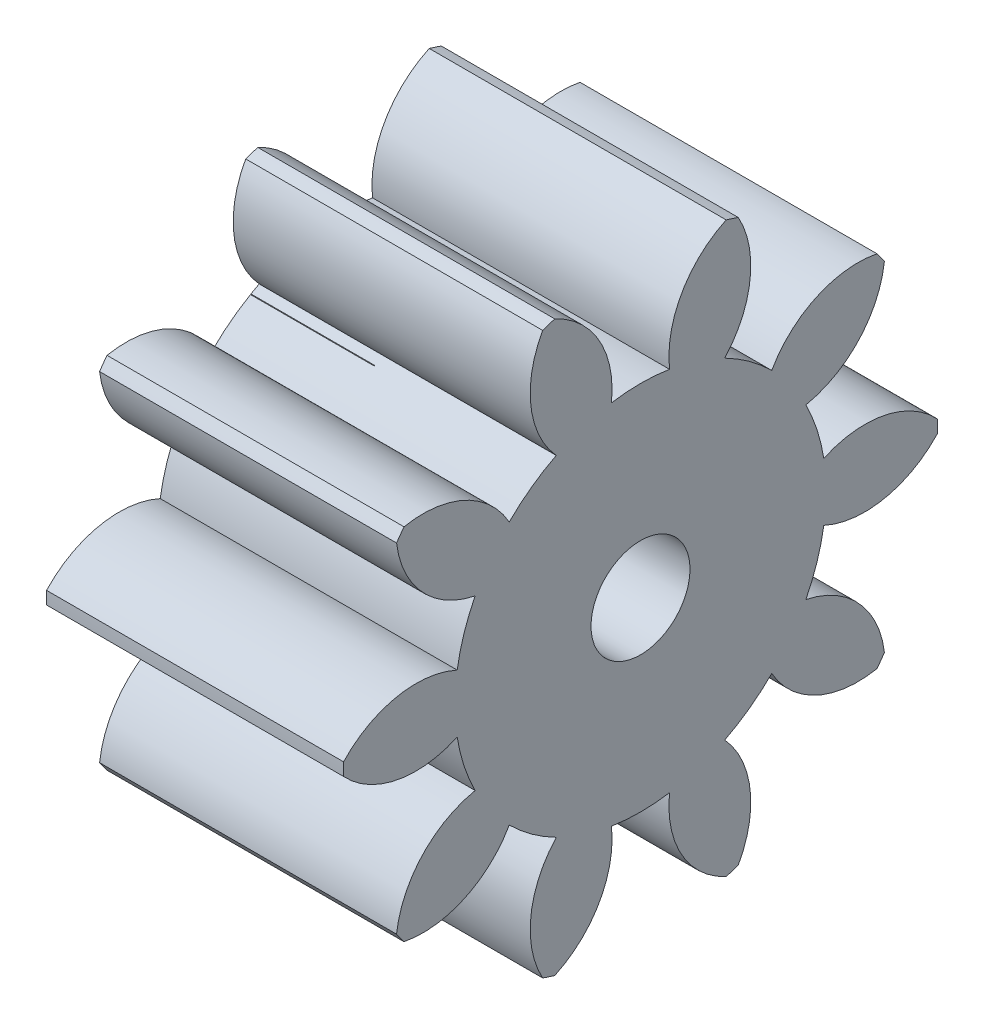
from build123d import *

# Parameters (mm, degrees)
BASPROSKE_W         = 12
BASPROSKE_H         = 12
TOOTHCUT_DEPTH      = 21.784609691
TEETHCUTS_COUNT     = 10
TEETHCUTS_ANGLE     = 324
BORSKE_R            = 2
BORE_DEPTH          = 50.0000508
CUT_EXTRUDE_1_DEPTH = 5


with BuildPart() as part:
    # BasProSke → Base-Revolve (revolve)
    with BuildSketch(Plane(origin=(0, 0, 0), x_dir=(1, 0, 0), z_dir=(0, 1, 0)), mode=Mode.PRIVATE) as base_revolve_sk:
        with Locations((6, 6)):
            Rectangle(BASPROSKE_W, BASPROSKE_H)
    revolve(base_revolve_sk.sketch.rotate(Axis((-10, 0, 0), (1, 0, 0)), 180), axis=Axis((-10, 0, 0), (1, 0, 0)))

    # TooCutSke → ToothCut (cut, through all)
    with BuildSketch(Plane(origin=(0, 0, 0), x_dir=(0, 0, -1), z_dir=(1, 0, 0))):
        with BuildLine():
            ThreePointArc((1.173662691, 7.406586048), (0, 7.499), (-1.173662691, 7.406586048))
            ThreePointArc((-1.173662691, 7.406586048), (-1.668191438, 9.834565786), (-3.497907776, 11.50542856))
            ThreePointArc((-3.497907776, 11.50542856), (0, 12.0254), (3.497907776, 11.50542856))
            ThreePointArc((3.497907776, 11.50542856), (1.668191438, 9.834565786), (1.173662691, 7.406586048))
        make_face()
    toothcut = extrude(amount=TOOTHCUT_DEPTH, mode=Mode.SUBTRACT)

    # TeethCuts: ToothCut ×10 about axis
    teethcuts_axis = Axis((-10, 0, 0), (1, 0, 0))
    for i in range(1, TEETHCUTS_COUNT):
        add(toothcut.rotate(teethcuts_axis, i * TEETHCUTS_ANGLE / (TEETHCUTS_COUNT - 1)), mode=Mode.SUBTRACT)

    # BorSke → Bore (cut, symmetric)
    with BuildSketch(Plane(origin=(0, 0, 0), x_dir=(0, 0, -1), z_dir=(1, 0, 0))):
        with Locations(Location((0, 0, 0), (0, 0, 180))):
            Circle(BORSKE_R)
    extrude(amount=BORE_DEPTH, both=True, mode=Mode.SUBTRACT)

    # Эскиз1 → Вырез-Вытянуть1 (cut)
    with BuildSketch(Plane.ZY):
        Polygon((7.505553499, 0), (3.75277675, 6.5), (-3.75277675, 6.5), (-7.505553499, 0), (-3.75277675, -6.5), (3.75277675, -6.5), align=None)
    extrude(amount=-CUT_EXTRUDE_1_DEPTH, mode=Mode.SUBTRACT)


solid = part.part
